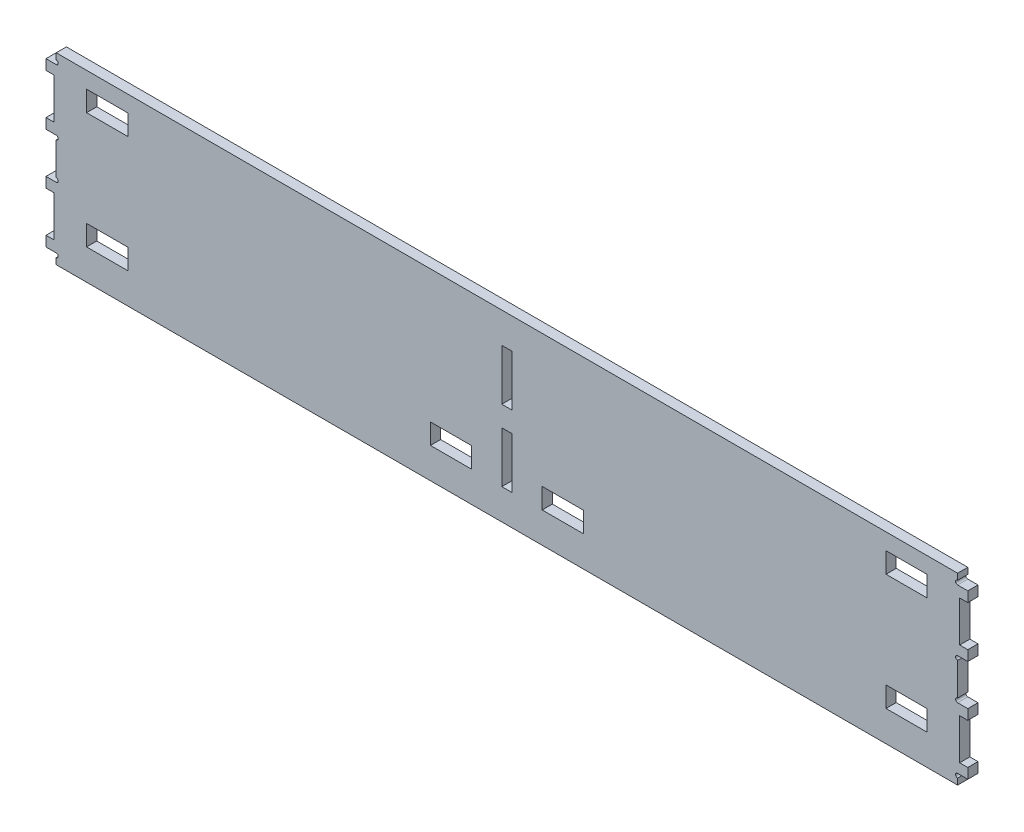
from build123d import *

# Parameters (mm, degrees)
SKETCH1_W               = 442
SKETCH1_H               = 90
BOSS_EXTRUDE1_DEPTH     = 5
SKETCH3_W               = 5
SKETCH3_H               = 25
CUT_EXTRUDE2_DEPTH      = 226.590336672
SKETCH5_W               = 5
SKETCH5_H               = 30
BOSS_EXTRUDE2_DEPTH     = 5
SKETCH6_W               = 5
SKETCH6_H               = 20
CUT_EXTRUDE4_DEPTH      = 4
SKETCH7_R               = 1
CUT_EXTRUDE5_DEPTH      = 231.490780727
SKETCH8_W               = 20.2
SKETCH8_H               = 10
CUT_EXTRUDE6_DEPTH      = 10
SKETCH9_W               = 20.2
SKETCH9_H               = 10
CUT_EXTRUDE7_DEPTH      = 300
MIRROR4_COPY_1_SKETCH_W = 20.2
MIRROR4_COPY_1_SKETCH_H = 10
MIRROR4_COPY_1_DEPTH    = 10


with BuildPart() as part:
    # Sketch1 → Boss-Extrude1 (new body)
    with BuildSketch(Plane.XY):
        Rectangle(SKETCH1_W, SKETCH1_H)
    extrude(amount=BOSS_EXTRUDE1_DEPTH)

    # Sketch3 → Cut-Extrude2 (cut, through all)
    with BuildSketch(Plane(origin=(0, 0, 0), x_dir=(-1, 0, 0), z_dir=(0, 0, -1))):
        with Locations((0, 17.5)):
            Rectangle(SKETCH3_W, SKETCH3_H)
        with Locations((0, -17.5)):
            Rectangle(SKETCH3_W, SKETCH3_H)
    extrude(amount=-CUT_EXTRUDE2_DEPTH, mode=Mode.SUBTRACT)

    # Sketch5 → Boss-Extrude2 (add)
    with BuildSketch(Plane(origin=(221, 0, 0), x_dir=(0, 0, -1), z_dir=(1, 0, 0))):
        with Locations((-2.5, 25)):
            Rectangle(SKETCH5_W, SKETCH5_H)
        with Locations((-2.5, -25)):
            Rectangle(SKETCH5_W, SKETCH5_H)
    boss_extrude2 = extrude(amount=BOSS_EXTRUDE2_DEPTH)

    # Sketch6 → Cut-Extrude4 (cut)
    with BuildSketch(Plane(origin=(226, 0, 0), x_dir=(0, 0, -1), z_dir=(1, 0, 0))):
        with Locations((-2.5, 25)):
            Rectangle(SKETCH6_W, SKETCH6_H)
        with Locations((-2.5, -25)):
            Rectangle(SKETCH6_W, SKETCH6_H)
    cut_extrude4 = extrude(amount=-CUT_EXTRUDE4_DEPTH, mode=Mode.SUBTRACT)

    # Mirror1: Boss-Extrude2, Cut-Extrude4 across plane
    add(boss_extrude2.mirror(Plane(origin=(0, 0, 0), x_dir=(0, 0, 1), z_dir=(1, 0, 0))))
    add(cut_extrude4.mirror(Plane(origin=(0, 0, 0), x_dir=(0, 0, 1), z_dir=(1, 0, 0))), mode=Mode.SUBTRACT)

    # Sketch7 → Cut-Extrude5 (cut, through all)
    with BuildSketch(Plane(origin=(0, 0, 0), x_dir=(-1, 0, 0), z_dir=(0, 0, -1))):
        with Locations((-221, 9)):
            Circle(SKETCH7_R)
        with Locations((-221, -9)):
            Circle(SKETCH7_R)
        with Locations((-221, -41)):
            Circle(SKETCH7_R)
        with Locations((221, -41)):
            Circle(SKETCH7_R)
        with Locations((221, -9)):
            Circle(SKETCH7_R)
        with Locations((221, 9)):
            Circle(SKETCH7_R)
        with Locations((-221, 41)):
            Circle(SKETCH7_R)
        with Locations((221, 41)):
            Circle(SKETCH7_R)
    extrude(amount=-CUT_EXTRUDE5_DEPTH, mode=Mode.SUBTRACT)

    # Sketch8 → Cut-Extrude6 (cut)
    with BuildSketch(Plane(origin=(102.718818309, -610.456150304, 5), x_dir=(1, 0, 0), z_dir=(0, 0, 1))):
        with Locations((93.281181691, 585.456150304)):
            Rectangle(SKETCH8_W, SKETCH8_H)
    cut_extrude6 = extrude(amount=-CUT_EXTRUDE6_DEPTH, mode=Mode.SUBTRACT)

    # Mirror2: Cut-Extrude6 across plane
    add(cut_extrude6.mirror(Plane(origin=(0, 0, 0), x_dir=(0, 0, 1), z_dir=(1, 0, 0))), mode=Mode.SUBTRACT)

    # Sketch9 → Cut-Extrude7 (cut)
    with BuildSketch(Plane(origin=(102.718818309, -610.456150304, 228.5), x_dir=(1, 0, 0), z_dir=(0, 0, 1))):
        with Locations((-130.118818309, 585.456150304)):
            Rectangle(SKETCH9_W, SKETCH9_H)
    cut_extrude7 = extrude(amount=-CUT_EXTRUDE7_DEPTH, mode=Mode.SUBTRACT)

    # Mirror3: Cut-Extrude7 across plane
    add(cut_extrude7.mirror(Plane(origin=(0, 0, 0), x_dir=(0, 0, 1), z_dir=(1, 0, 0))), mode=Mode.SUBTRACT)

    # Mirror4: Cut-Extrude6 across plane
    add(cut_extrude6.mirror(Plane.ZX.offset(3.5)), mode=Mode.SUBTRACT)

    # Mirror4 copy 1 sketch → Mirror4 copy 1 (cut)
    with BuildSketch(Plane(origin=(-102.718818309, 617.456150304, 5), x_dir=(-1, 0, 0), z_dir=(0, 0, 1))):
        with Locations((93.281181691, 585.456150304)):
            Rectangle(MIRROR4_COPY_1_SKETCH_W, MIRROR4_COPY_1_SKETCH_H)
    extrude(amount=-MIRROR4_COPY_1_DEPTH, mode=Mode.SUBTRACT)


solid = part.part
